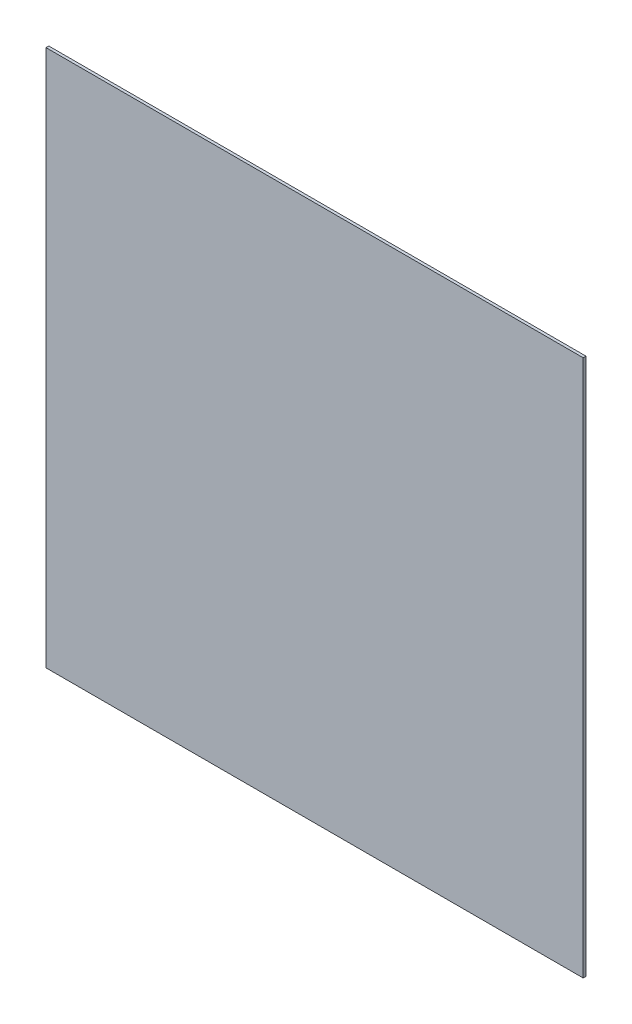
from build123d import *

# Parameters (mm, degrees)
SKETCH1_W           = 609.6
SKETCH1_H           = 609.6
BOSS_EXTRUDE1_DEPTH = 3.175


with BuildPart() as part:
    # Sketch1 → Boss-Extrude1 (new body)
    with BuildSketch(Plane.XY):
        Rectangle(SKETCH1_W, SKETCH1_H)
    extrude(amount=BOSS_EXTRUDE1_DEPTH)


solid = part.part
